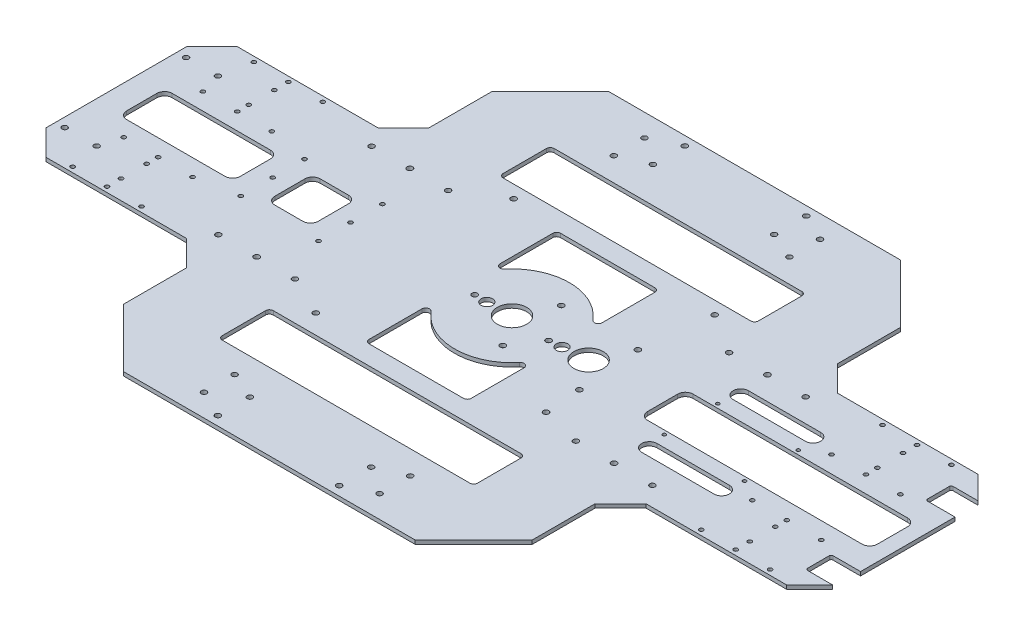
from build123d import *

# Parameters (mm, degrees)
EXTRUDE_1_DEPTH      = 3
CHAMFER_1_SIZE       = 20
SKETCH_2_W           = 320
SKETCH_2_H           = 20
CUT_EXTRUDE_1_DEPTH  = 5
CHAMFER_2_SIZE       = 50
SKETCH_3_R           = 2.1
SKETCH_3_R_2         = 2.099999999
SKETCH_3_R_3         = 2.100000001
CUT_EXTRUDE_2_DEPTH  = 80
SKETCH_4_R           = 2.15
CUT_EXTRUDE_3_DEPTH  = 10
SKETCH_5_R           = 1.6
SKETCH_5_R_2         = 2.1
SKETCH_5_R_3         = 2.2
CUT_EXTRUDE_4_DEPTH  = 29
EXTRUDE_2_DEPTH      = 3
SKETCH_7_W           = 23
SKETCH_7_H           = 20
CUT_EXTRUDE_5_DEPTH  = 3
FILLET_1_R           = 1.5
SKETCH_9_R           = 2.150000001
SKETCH_9_R_2         = 2.15
CUT_EXTRUDE_6_DEPTH  = 3
SKETCH_10_R          = 11.5
SKETCH_10_R_2        = 4.5
SKETCH_10_R_3        = 2.15
CUT_EXTRUDE_7_DEPTH  = 5
SKETCH_11_R          = 1.6
CUT_EXTRUDE_8_DEPTH  = 10
SKETCH_13_R          = 1.35
CUT_EXTRUDE_9_DEPTH  = 3
CUT_EXTRUDE_10_DEPTH = 3
CUT_EXTRUDE_START    = -3
SKETCH_15_R          = 2.15
SKETCH_15_R_2        = 4.5
SKETCH_15_R_3        = 11.5
CUT_EXTRUDE_11_DEPTH = 3
CUT_EXTRUDE_12_DEPTH = 3
CUT_EXTRUDE_13_DEPTH = 3


with BuildPart() as part:
    # 草图1 → 凸台-拉伸1 (new body)
    with BuildSketch(Plane(origin=(0, 0, 0), x_dir=(1, 0, 0), z_dir=(0, 1, 0))):
        Polygon((-310, -75), (-160, -75), (-160, -200), (160, -200), (160, -75), (310, -75), (310, 75), (160, 75), (160, 200), (-160, 200), (-160, 75), (-310, 75), align=None)
    extrude(amount=EXTRUDE_1_DEPTH)

    # 倒角1
    chamfer_1_edges = [part.edges().sort_by_distance(p)[0] for p in [
        (310, 1.5, -75),
        (310, 1.5, 75),
        (160, 1.5, 75),
        (-160, 1.5, 75),
        (-310, 1.5, 75),
        (-310, 1.5, -75),
        (-160, 1.5, -75),
        (160, 1.5, -75),
    ]]
    chamfer(chamfer_1_edges, length=CHAMFER_1_SIZE)

    # 草图2 → 切除-拉伸1 (cut)
    with BuildSketch(Plane(origin=(0, 3, 0), x_dir=(1, 0, 0), z_dir=(0, 1, 0))):
        with Locations((0, 190)):
            Rectangle(SKETCH_2_W, SKETCH_2_H)
        with Locations((0, -190)):
            Rectangle(SKETCH_2_W, SKETCH_2_H)
    extrude(amount=-CUT_EXTRUDE_1_DEPTH, mode=Mode.SUBTRACT)

    # 倒角2
    chamfer_2_edges = [part.edges().sort_by_distance(p)[0] for p in [
        (-160, 1.5, 180),
        (-160, 1.5, -180),
        (160, 1.5, -180),
        (160, 1.5, 180),
    ]]
    chamfer(chamfer_2_edges, length=CHAMFER_2_SIZE)

    # 草图3 → 切除-拉伸2 (cut)
    with BuildSketch(Plane(origin=(0, 3, 0), x_dir=(1, 0, 0), z_dir=(0, 1, 0))):
        with Locations(Location((-302.826293853, 47.5, 0), (0, 0, 270))):
            Circle(SKETCH_3_R)
        with Locations(Location((-277.826293853, 47.5, 0), (0, 0, 270))):
            Circle(SKETCH_3_R)
        with Locations((-47.5, 182.826293853)):
            Circle(SKETCH_3_R)
        with Locations(Location((-47.5, 157.826293853, 0), (0, 0, 270))):
            Circle(SKETCH_3_R)
        with Locations((47.5, 182.826293853)):
            Circle(SKETCH_3_R)
        with Locations(Location((47.5, 157.826293853, 0), (0, 0, 270))):
            Circle(SKETCH_3_R)
        with Locations(Location((302.700177837, 47.5, 0), (0, 0, 270))):
            Circle(SKETCH_3_R_2)
        with Locations((327.700177837, 47.5)):
            Circle(SKETCH_3_R_2)
        with Locations(Location((-68.75, 172.5, 0), (0, 0, 270))):
            Circle(SKETCH_3_R)
        with Locations(Location((-68.75, 148.5, 0), (0, 0, 270))):
            Circle(SKETCH_3_R)
        with Locations(Location((68.75, 172.5, 0), (0, 0, 270))):
            Circle(SKETCH_3_R)
        with Locations(Location((68.75, 148.5, 0), (0, 0, 270))):
            Circle(SKETCH_3_R)
        with Locations(Location((68.75, -148.5, 0), (0, 0, 270))):
            Circle(SKETCH_3_R)
        with Locations(Location((68.75, -172.5, 0), (0, 0, 270))):
            Circle(SKETCH_3_R)
        with Locations(Location((-68.75, -148.5, 0), (0, 0, 270))):
            Circle(SKETCH_3_R)
        with Locations(Location((-68.75, -172.5, 0), (0, 0, 270))):
            Circle(SKETCH_3_R)
        with Locations((327.700177837, -47.5)):
            Circle(SKETCH_3_R_3)
        with Locations(Location((302.700177837, -47.5, 0), (0, 0, 270))):
            Circle(SKETCH_3_R_3)
        with Locations(Location((47.5, -157.826293853, 0), (0, 0, 270))):
            Circle(SKETCH_3_R)
        with Locations((47.5, -182.826293853)):
            Circle(SKETCH_3_R)
        with Locations(Location((-47.5, -157.826293853, 0), (0, 0, 270))):
            Circle(SKETCH_3_R)
        with Locations((-47.5, -182.826293853)):
            Circle(SKETCH_3_R)
        with Locations(Location((-277.826293853, -47.5, 0), (0, 0, 270))):
            Circle(SKETCH_3_R)
        with Locations(Location((-302.826293853, -47.5, 0), (0, 0, 270))):
            Circle(SKETCH_3_R)
    extrude(amount=-CUT_EXTRUDE_2_DEPTH, mode=Mode.SUBTRACT)

    # 草图4 → 切除-拉伸3 (cut)
    with BuildSketch(Plane.XZ):
        with Locations(Location((-78.739999994, 74.909999989, 0), (0, 0, 270))):
            Circle(SKETCH_4_R)
        with Locations(Location((-78.739999994, -80.01, 0), (0, 0, 270))):
            Circle(SKETCH_4_R)
        with Locations(Location((78.740000006, -80.01, 0), (0, 0, 270))):
            Circle(SKETCH_4_R)
        with Locations(Location((78.740000006, 52.07, 0), (0, 0, 270))):
            Circle(SKETCH_4_R)
    extrude(amount=-CUT_EXTRUDE_3_DEPTH, mode=Mode.SUBTRACT)

    # 草图5 → 切除-拉伸4 (cut)
    with BuildSketch(Plane(origin=(0, 3, 0), x_dir=(1, 0, 0), z_dir=(0, 1, 0))):
        with Locations(Location((219.200177837, 71, 0), (0, 0, 270))):
            Circle(SKETCH_5_R)
        with Locations(Location((273.200177837, 71, 0), (0, 0, 270))):
            Circle(SKETCH_5_R)
        with Locations(Location((246.200177837, 71, 0), (0, 0, 270))):
            Circle(SKETCH_5_R)
        with Locations(Location((219.200177837, 30.998400192, 0), (0, 0, 270))):
            Circle(SKETCH_5_R)
        with Locations(Location((246.200177837, 30.998400192, 0), (0, 0, 270))):
            Circle(SKETCH_5_R)
        with Locations(Location((273.200177837, 30.998400192, 0), (0, 0, 270))):
            Circle(SKETCH_5_R)
        with Locations(Location((246.200177837, 60, 0), (0, 0, 270))):
            Circle(SKETCH_5_R)
        with Locations(Location((246.200177837, 40, 0), (0, 0, 270))):
            Circle(SKETCH_5_R)
        with Locations(Location((246.200177837, -40, 0), (0, 0, 270))):
            Circle(SKETCH_5_R)
        with Locations(Location((246.200177837, -60, 0), (0, 0, 270))):
            Circle(SKETCH_5_R)
        with Locations(Location((273.200177837, -30.998400192, 0), (0, 0, 270))):
            Circle(SKETCH_5_R)
        with Locations(Location((246.200177837, -30.998400192, 0), (0, 0, 270))):
            Circle(SKETCH_5_R)
        with Locations(Location((219.200177837, -30.998400192, 0), (0, 0, 270))):
            Circle(SKETCH_5_R)
        with Locations(Location((246.200177837, -71, 0), (0, 0, 270))):
            Circle(SKETCH_5_R)
        with Locations(Location((273.200177837, -71, 0), (0, 0, 270))):
            Circle(SKETCH_5_R)
        with Locations(Location((219.200177837, -71, 0), (0, 0, 270))):
            Circle(SKETCH_5_R)
        with Locations(Location((-219.200177837, -71, 0), (0, 0, 270))):
            Circle(SKETCH_5_R)
        with Locations(Location((-273.200177837, -71, 0), (0, 0, 270))):
            Circle(SKETCH_5_R)
        with Locations(Location((-246.200177837, -71, 0), (0, 0, 270))):
            Circle(SKETCH_5_R)
        with Locations(Location((-219.200177837, -30.998400192, 0), (0, 0, 270))):
            Circle(SKETCH_5_R)
        with Locations(Location((-246.200177837, -30.998400192, 0), (0, 0, 270))):
            Circle(SKETCH_5_R)
        with Locations(Location((-273.200177837, -30.998400192, 0), (0, 0, 270))):
            Circle(SKETCH_5_R)
        with Locations(Location((-246.200177837, -60, 0), (0, 0, 270))):
            Circle(SKETCH_5_R)
        with Locations(Location((-246.200177837, -40, 0), (0, 0, 270))):
            Circle(SKETCH_5_R)
        with Locations(Location((-246.200177837, 40, 0), (0, 0, 270))):
            Circle(SKETCH_5_R)
        with Locations(Location((-246.200177837, 60, 0), (0, 0, 270))):
            Circle(SKETCH_5_R)
        with Locations(Location((-273.200177837, 30.998400192, 0), (0, 0, 270))):
            Circle(SKETCH_5_R)
        with Locations(Location((-246.200177837, 30.998400192, 0), (0, 0, 270))):
            Circle(SKETCH_5_R)
        with Locations(Location((-219.200177837, 30.998400192, 0), (0, 0, 270))):
            Circle(SKETCH_5_R)
        with Locations(Location((-246.200177837, 71, 0), (0, 0, 270))):
            Circle(SKETCH_5_R)
        with Locations(Location((-273.200177837, 71, 0), (0, 0, 270))):
            Circle(SKETCH_5_R)
        with Locations(Location((-219.200177837, 71, 0), (0, 0, 270))):
            Circle(SKETCH_5_R)
        with Locations(Location((170, -60, 0), (0, 0, 270))):
            Circle(SKETCH_5_R_2)
        with Locations(Location((110, -60, 0), (0, 0, 270))):
            Circle(SKETCH_5_R_2)
        with Locations(Location((140, -60, 0), (0, 0, 270))):
            Circle(SKETCH_5_R_3)
        with Locations(Location((140, 60, 0), (0, 0, 270))):
            Circle(SKETCH_5_R_3)
        with Locations(Location((110, 60, 0), (0, 0, 270))):
            Circle(SKETCH_5_R_2)
        with Locations(Location((170, 60, 0), (0, 0, 270))):
            Circle(SKETCH_5_R_2)
        with Locations(Location((-170, 60, 0), (0, 0, 270))):
            Circle(SKETCH_5_R_2)
        with Locations(Location((-110, 60, 0), (0, 0, 270))):
            Circle(SKETCH_5_R_2)
        with Locations(Location((-140, 60, 0), (0, 0, 270))):
            Circle(SKETCH_5_R_3)
        with Locations(Location((-140, -60, 0), (0, 0, 270))):
            Circle(SKETCH_5_R_3)
        with Locations(Location((-110, -60, 0), (0, 0, 270))):
            Circle(SKETCH_5_R_2)
        with Locations(Location((-170, -60, 0), (0, 0, 270))):
            Circle(SKETCH_5_R_2)
    extrude(amount=-CUT_EXTRUDE_4_DEPTH, mode=Mode.SUBTRACT)

    # 草图6 → 凸台-拉伸2 (add)
    with BuildSketch(Plane(origin=(0, 3, 0), x_dir=(1, 0, 0), z_dir=(0, 1, 0))):
        Polygon((-160, 144.142135624), (-160, 130), (-110, 180), (110, 180), (160, 130), (160, 144.142135624), (114.142135624, 190), (-114.142135624, 190), align=None)
        Polygon((114.142135624, -190), (160, -144.142135624), (160, -130), (110, -180), (-110, -180), (-160, -130), (-160, -144.142135624), (-114.142135624, -190), align=None)
    extrude(amount=-EXTRUDE_2_DEPTH)

    # 草图7 → 切除-拉伸5 (cut)
    with BuildSketch(Plane(origin=(0, 3, 0), x_dir=(1, 0, 0), z_dir=(0, 1, 0))):
        with Locations((298.5, 47)):
            Rectangle(SKETCH_7_W, SKETCH_7_H)
        with Locations((298.5, -47)):
            Rectangle(SKETCH_7_W, SKETCH_7_H)
    extrude(amount=-CUT_EXTRUDE_5_DEPTH, mode=Mode.SUBTRACT)

    # 圆角1
    fillet_1_edges = [part.edges().sort_by_distance(p)[0] for p in [
        (287, 1.5, -37),
        (287, 1.5, -57),
        (287, 1.5, 57),
        (287, 1.5, 37),
    ]]
    fillet(fillet_1_edges, radius=FILLET_1_R)

    # 草图9 → 切除-拉伸6 (cut)
    with BuildSketch(Plane.XZ):
        with Locations(Location((-47.500000001, 182.87842708, 0), (0, 0, 270))):
            Circle(SKETCH_9_R)
        with Locations(Location((47.5, 182.87842708, 0), (0, 0, 270))):
            Circle(SKETCH_9_R)
        with Locations(Location((47.5, -182.87842708, 0), (0, 0, 90))):
            Circle(SKETCH_9_R_2)
        with Locations(Location((-47.500000001, -182.87842708, 0), (0, 0, 90))):
            Circle(SKETCH_9_R_2)
    extrude(amount=-CUT_EXTRUDE_6_DEPTH, mode=Mode.SUBTRACT)

    # 草图10 → 切除-拉伸7 (cut)
    with BuildSketch(Plane.XZ):
        with Locations(Location((60, 0, 0), (0, 0, 270))):
            Circle(SKETCH_10_R)
        with Locations(Location((40.818485661, 1.62234634, 0), (0, 0, 270))):
            Circle(SKETCH_10_R_2)
        with Locations(Location((72.33180035, -26.247413208, 0), (0, 0, 270))):
            Circle(SKETCH_10_R_3)
        with Locations(Location((76.565026447, 23.803358982, 0), (0, 0, 270))):
            Circle(SKETCH_10_R_3)
        with Locations(Location((31.103173203, 2.444054227, 0), (0, 0, 270))):
            Circle(SKETCH_10_R_3)
    extrude(amount=-CUT_EXTRUDE_7_DEPTH, mode=Mode.SUBTRACT)

    # 草图11 → 切除-拉伸8 (cut)
    with BuildSketch(Plane.XZ):
        with Locations(Location((-126.5, -25, 0), (0, 0, 270))):
            Circle(SKETCH_11_R)
        with Locations(Location((-187.5, -25, 0), (0, 0, 270))):
            Circle(SKETCH_11_R)
        with Locations(Location((-126.5, 0, 0), (0, 0, 270))):
            Circle(SKETCH_11_R)
        with Locations(Location((-187.4745166, 0, 0), (0, 0, 270))):
            Circle(SKETCH_11_R)
        with Locations(Location((-187.4745166, 25, 0), (0, 0, 270))):
            Circle(SKETCH_11_R)
        with Locations(Location((-126.5, 25, 0), (0, 0, 270))):
            Circle(SKETCH_11_R)
    extrude(amount=-CUT_EXTRUDE_8_DEPTH, mode=Mode.SUBTRACT)

    # 草图13 → 切除-拉伸9 (cut)
    with BuildSketch(Plane(origin=(0, 3, 0), x_dir=(1, 0, 0), z_dir=(0, 1, 0))):
        with Locations(Location((140.200177837, 21, 0), (0, 0, 270))):
            Circle(SKETCH_13_R)
        with Locations(Location((203.200177837, 21, 0), (0, 0, 270))):
            Circle(SKETCH_13_R)
        with Locations(Location((203.200177837, -21, 0), (0, 0, 270))):
            Circle(SKETCH_13_R)
        with Locations(Location((140.200177837, -21, 0), (0, 0, 270))):
            Circle(SKETCH_13_R)
        with BuildLine():
            Line((143.400177837, 41.8), (200.000177837, 41.8))
            ThreePointArc((200.000177837, 41.8), (206.000177837, 35.8), (200.000177837, 29.8))
            Line((200.000177837, 29.8), (143.400177837, 29.8))
            ThreePointArc((143.400177837, 29.8), (137.400177837, 35.8), (143.400177837, 41.8))
        make_face()
        with BuildLine():
            Line((143.400177837, -29.8), (200.000177837, -29.8))
            ThreePointArc((200.000177837, -29.8), (206.000177837, -35.8), (200.000177837, -41.8))
            Line((200.000177837, -41.8), (143.400177837, -41.8))
            ThreePointArc((143.400177837, -41.8), (137.400177837, -35.8), (143.400177837, -29.8))
        make_face()
    extrude(amount=-CUT_EXTRUDE_9_DEPTH, mode=Mode.SUBTRACT)

    # 草图14 → 切除-拉伸10 (cut)
    with BuildSketch(Plane(origin=(0, 3, 0), x_dir=(1, 0, 0), z_dir=(0, 1, 0))):
        with BuildLine():
            Line((292, 17.8), (124, 17.8))
            ThreePointArc((124, 17.8), (119.757359313, 16.042640687), (118, 11.8))
            Line((118, 11.8), (118, -11.8))
            ThreePointArc((118, -11.8), (119.757359313, -16.042640687), (124, -17.8))
            Line((124, -17.8), (292, -17.8))
            ThreePointArc((292, -17.8), (296.242640687, -16.042640687), (298, -11.8))
            Line((298, -11.8), (298, 11.8))
            ThreePointArc((298, 11.8), (296.242640687, 16.042640687), (292, 17.8))
        make_face()
    extrude(amount=-CUT_EXTRUDE_10_DEPTH, mode=Mode.SUBTRACT)

    # 草图15 → 切除-拉伸11 (cut)
    with BuildSketch(Plane(origin=(0, 3, 0), x_dir=(1, 0, 0), z_dir=(0, 1, 0)).offset(CUT_EXTRUDE_START)):
        with Locations(Location((76.565026447, -23.803358982, 0), (0, 0, 90))):
            Circle(SKETCH_15_R)
        with Locations(Location((72.33180035, 26.247413208, 0), (0, 0, 90))):
            Circle(SKETCH_15_R)
        with Locations(Location((31.103173203, -2.444054227, 0), (0, 0, 90))):
            Circle(SKETCH_15_R)
        with Locations(Location((40.818485661, -1.62234634, 0), (0, 0, 90))):
            Circle(SKETCH_15_R_2)
        with Locations(Location((60, 0, 0), (0, 0, 90))):
            Circle(SKETCH_15_R_3)
        with Locations(Location((16.565026447, -23.803358982, 0), (0, 0, 270))):
            Circle(SKETCH_15_R)
        with Locations(Location((12.33180035, 26.247413208, 0), (0, 0, 270))):
            Circle(SKETCH_15_R)
        with Locations(Location((-28.896826797, -0.34594168, 0), (0, 0, 270))):
            Circle(SKETCH_15_R)
        with Locations(Location((-19.181514339, -0.523817525, 0), (0, 0, 270))):
            Circle(SKETCH_15_R_2)
        with Locations(Location((0, 0, 0), (0, 0, 270))):
            Circle(SKETCH_15_R_3)
    extrude(amount=CUT_EXTRUDE_11_DEPTH, mode=Mode.SUBTRACT)

    # 草图16 → 切除-拉伸12 (cut)
    with BuildSketch(Plane(origin=(0, 3, 0), x_dir=(1, 0, 0), z_dir=(0, 1, 0))):
        with BuildLine():
            Line((40, 90), (97, 90))
            ThreePointArc((97, 90), (99.121320344, 90.878679656), (100, 93))
            Line((100, 93), (100, 127))
            ThreePointArc((100, 127), (99.121320344, 129.121320344), (97, 130))
            Line((97, 130), (-97, 130))
            ThreePointArc((-97, 130), (-99.121320344, 129.121320344), (-100, 127))
            Line((-100, 127), (-100, 93))
            ThreePointArc((-100, 93), (-99.121320344, 90.878679656), (-97, 90))
            Line((-97, 90), (-40, 90))
            Line((-40, 90), (40, 90))
        make_face()
        with BuildLine():
            ThreePointArc((-34.6875, 28.666659096), (-38.015504801, 27.754872255), (-40, 30.577769703))
            Line((-40, 30.577769703), (-40, 72))
            ThreePointArc((-40, 72), (-39.121320344, 74.121320344), (-37, 75))
            Line((-37, 75), (37, 75))
            ThreePointArc((37, 75), (39.121320344, 74.121320344), (40, 72))
            Line((40, 72), (40, 30.577769703))
            ThreePointArc((40, 30.577769703), (38.015504801, 27.754872255), (34.6875, 28.666659096))
            ThreePointArc((34.6875, 28.666659096), (0, 45), (-34.6875, 28.666659096))
        make_face()
        with BuildLine():
            Line((40, -30.577769703), (40, -72))
            ThreePointArc((40, -72), (39.121320344, -74.121320344), (37, -75))
            Line((37, -75), (-37, -75))
            ThreePointArc((-37, -75), (-39.121320344, -74.121320344), (-40, -72))
            Line((-40, -72), (-40, -30.577769703))
            ThreePointArc((-40, -30.577769703), (-38.015504801, -27.754872255), (-34.6875, -28.666659096))
            ThreePointArc((-34.6875, -28.666659096), (0, -45), (34.6875, -28.666659096))
            ThreePointArc((34.6875, -28.666659096), (38.015504801, -27.754872255), (40, -30.577769703))
        make_face()
        with BuildLine():
            Line((40, -90), (-40, -90))
            Line((-40, -90), (-97, -90))
            ThreePointArc((-97, -90), (-99.121320344, -90.878679656), (-100, -93))
            Line((-100, -93), (-100, -127))
            ThreePointArc((-100, -127), (-99.121320344, -129.121320344), (-97, -130))
            Line((-97, -130), (-40, -130))
            Line((-40, -130), (40, -130))
            Line((40, -130), (97, -130))
            ThreePointArc((97, -130), (99.121320344, -129.121320344), (100, -127))
            Line((100, -127), (100, -93))
            ThreePointArc((100, -93), (99.121320344, -90.878679656), (97, -90))
            Line((97, -90), (40, -90))
        make_face()
    extrude(amount=-CUT_EXTRUDE_12_DEPTH, mode=Mode.SUBTRACT)

    # 草图17 → 切除-拉伸13 (cut)
    with BuildSketch(Plane(origin=(0, 3, 0), x_dir=(1, 0, 0), z_dir=(0, 1, 0))):
        with BuildLine():
            Line((-283.954023474, 17.8), (-207, 17.8))
            ThreePointArc((-207, 17.8), (-202.757359313, 16.042640687), (-201, 11.8))
            Line((-201, 11.8), (-201, -11.8))
            ThreePointArc((-201, -11.8), (-202.757359313, -16.042640687), (-207, -17.8))
            Line((-207, -17.8), (-283.954023474, -17.8))
            ThreePointArc((-283.954023474, -17.8), (-288.196664161, -16.042640687), (-289.954023474, -11.8))
            Line((-289.954023474, -11.8), (-289.954023474, 11.8))
            ThreePointArc((-289.954023474, 11.8), (-288.196664161, 16.042640687), (-283.954023474, 17.8))
        make_face()
        with BuildLine():
            Line((-168, 17.8), (-146, 17.8))
            ThreePointArc((-146, 17.8), (-141.757359313, 16.042640687), (-140, 11.8))
            Line((-140, 11.8), (-140, -11.8))
            ThreePointArc((-140, -11.8), (-141.757359313, -16.042640687), (-146, -17.8))
            Line((-146, -17.8), (-168, -17.8))
            ThreePointArc((-168, -17.8), (-172.242640687, -16.042640687), (-174, -11.8))
            Line((-174, -11.8), (-174, 11.8))
            ThreePointArc((-174, 11.8), (-172.242640687, 16.042640687), (-168, 17.8))
        make_face()
    extrude(amount=-CUT_EXTRUDE_13_DEPTH, mode=Mode.SUBTRACT)


solid = part.part
